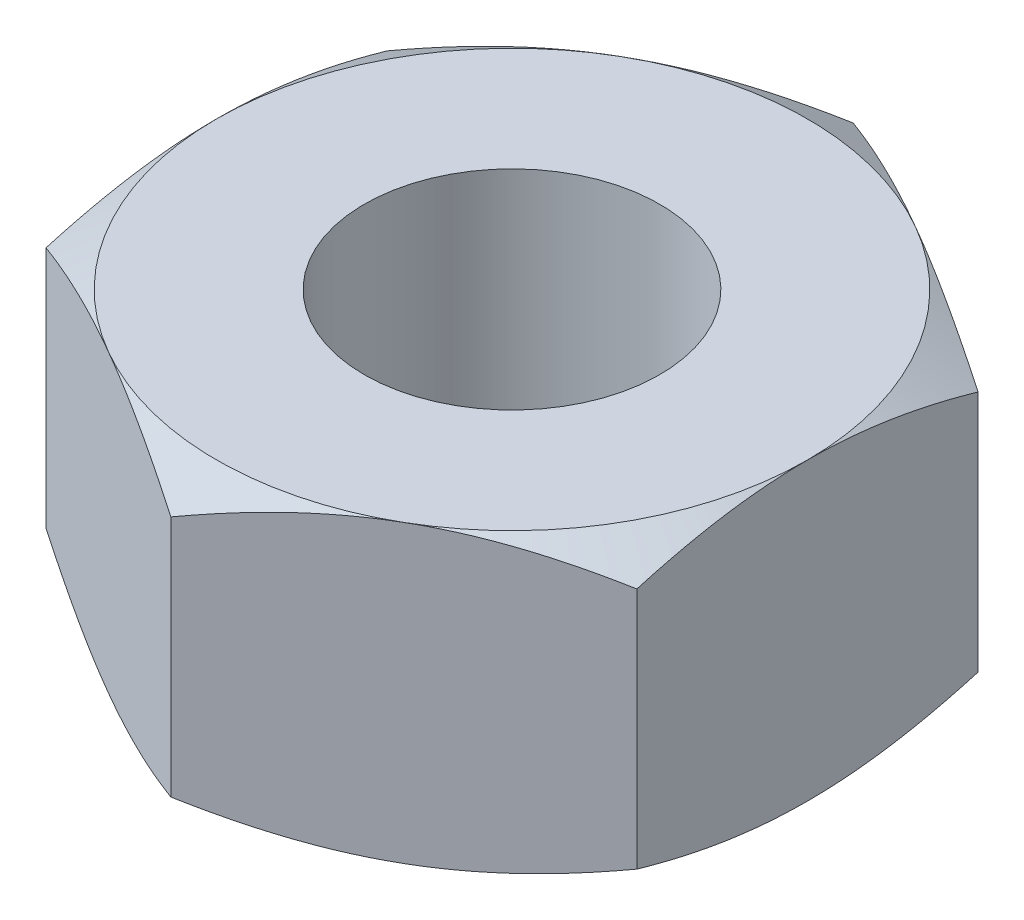
from build123d import *

# Parameters (mm, degrees)
SKETCH1_R           = 1
BOSS_EXTRUDE1_DEPTH = 2
SKETCH2_OUTSIDE_W   = 14.214
SKETCH2_OUTSIDE_H   = 14.832
SKETCH2_OUTSIDE_R   = 2
CUT_EXTRUDE1_DEPTH  = 2
CUT_EXTRUDE1_DRAFT  = -60
SKETCH3_OUTSIDE_W   = 14.214
SKETCH3_OUTSIDE_H   = 14.832
SKETCH3_OUTSIDE_R   = 2
CUT_EXTRUDE2_DEPTH  = 2
CUT_EXTRUDE2_DRAFT  = -60


with BuildPart() as part:
    # Sketch1 → Boss-Extrude1 (new body)
    with BuildSketch(Plane(origin=(0, 0, 0), x_dir=(1, 0, 0), z_dir=(0, 1, 0))):
        Polygon((0, 2.309401077), (-2, 1.154700538), (-2, -1.154700538), (0, -2.309401077), (2, -1.154700538), (2, 1.154700538), align=None)
        with Locations(Location((0, 0, 0), (0, 0, 270))):
            Circle(SKETCH1_R, mode=Mode.SUBTRACT)
    extrude(amount=BOSS_EXTRUDE1_DEPTH)


with BuildPart() as cut_extrude1_tool:
    # Sketch2 outside → Cut-Extrude1 (with draft: the straight prism first)
    with BuildSketch(Plane(origin=(0, 2, 0), x_dir=(1, 0, 0), z_dir=(0, 1, 0))):
        Rectangle(SKETCH2_OUTSIDE_W, SKETCH2_OUTSIDE_H)
        Circle(SKETCH2_OUTSIDE_R, mode=Mode.SUBTRACT)
    extrude(amount=-CUT_EXTRUDE1_DEPTH)
    # Cut-Extrude1: the draft: its side faces are tilted about the plane it starts from
    cut_extrude1_sides = [cut_extrude1_tool.faces().sort_by_distance(p)[0] for p in [
        (0, 1, 7.416),
        (7.107, 1, 0),
        (0, 1, -7.416),
        (-7.107, 1, 0),
        (-2, 1, 0),
    ]]
    draft(cut_extrude1_sides, Plane(origin=(0, 2, 0), x_dir=(1, 0, 0), z_dir=(0, 1, 0)), CUT_EXTRUDE1_DRAFT)


with BuildPart() as part_1:
    add(part.part)

    # Cut-Extrude1: cut by cut_extrude1_tool
    add(cut_extrude1_tool.part, mode=Mode.SUBTRACT)


with BuildPart() as cut_extrude2_tool:
    # Sketch3 outside → Cut-Extrude2 (with draft: the straight prism first)
    with BuildSketch(Plane.XZ):
        Rectangle(SKETCH3_OUTSIDE_W, SKETCH3_OUTSIDE_H)
        Circle(SKETCH3_OUTSIDE_R, mode=Mode.SUBTRACT)
    extrude(amount=-CUT_EXTRUDE2_DEPTH)
    # Cut-Extrude2: the draft: its side faces are tilted about the plane it starts from
    cut_extrude2_sides = [cut_extrude2_tool.faces().sort_by_distance(p)[0] for p in [
        (0, 1, -7.416),
        (7.107, 1, 0),
        (0, 1, 7.416),
        (-7.107, 1, 0),
        (-2, 1, 0),
    ]]
    draft(cut_extrude2_sides, Plane.XZ, CUT_EXTRUDE2_DRAFT)


with BuildPart() as part_2:
    add(part_1.part)

    # Cut-Extrude2: cut by cut_extrude2_tool
    add(cut_extrude2_tool.part, mode=Mode.SUBTRACT)


solid = part_2.part
